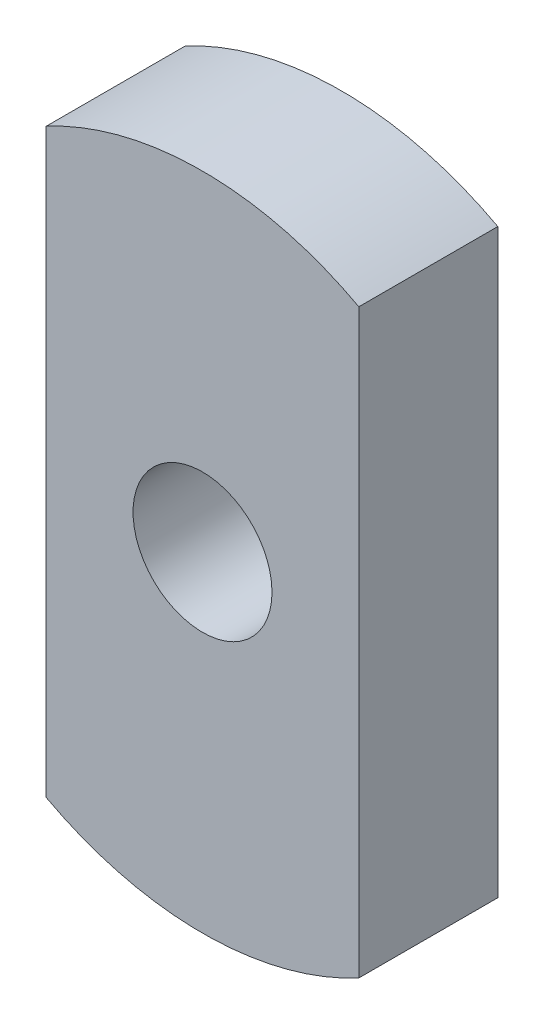
from build123d import *

# Parameters (mm, degrees)
SKETCH1_R           = 2
BOSS_EXTRUDE1_DEPTH = 4


with BuildPart() as part:
    # Sketch1 → Boss-Extrude1 (new body)
    with BuildSketch(Plane.XY):
        with BuildLine():
            Line((-4.5, 8.366600265), (-4.5, -8.366600265))
            ThreePointArc((-4.5, -8.366600265), (0, -9.5), (4.5, -8.366600265))
            Line((4.5, -8.366600265), (4.5, 8.366600265))
            ThreePointArc((4.5, 8.366600265), (0, 9.5), (-4.5, 8.366600265))
        make_face()
        Circle(SKETCH1_R, mode=Mode.SUBTRACT)
    extrude(amount=BOSS_EXTRUDE1_DEPTH)


solid = part.part
